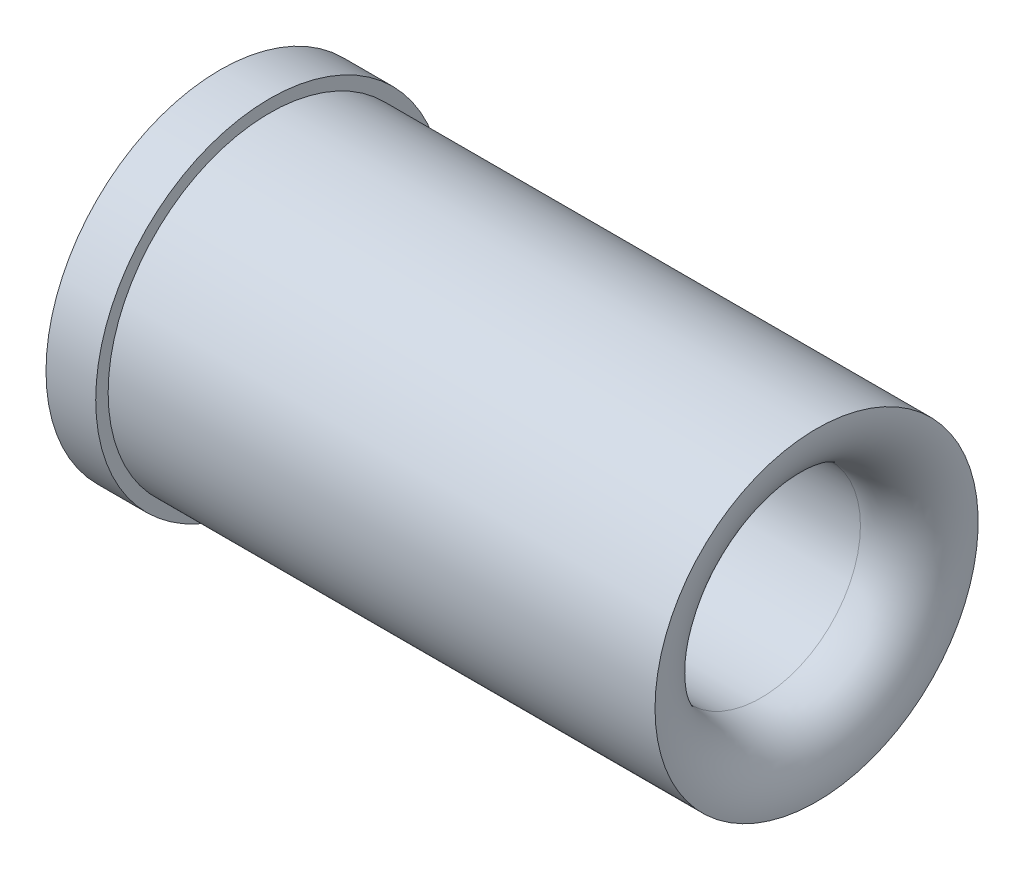
from build123d import *


with BuildPart() as part:
    # Sketch1 → Revolve1 (revolve)
    with BuildSketch(Plane(origin=(0, 0, 0), x_dir=(-1, 0, 0), z_dir=(0, 0, -1)), mode=Mode.PRIVATE) as revolve1_sk:
        with BuildLine():
            Line((-11.294089345, -6.533263235), (-0.912123334, -6.533263235))
            Line((-0.912123334, -6.533263235), (-0.912123334, -5.033263235))
            Line((-0.912123334, -5.033263235), (-1.912123334, -5.033263235))
            Line((-1.912123334, -5.033263235), (-1.912123334, -5.283263235))
            Line((-1.912123334, -5.283263235), (-12.912123334, -5.283263235))
            ThreePointArc((-12.912123334, -5.283263235), (-12.632614837, -6.158263235), (-11.794089345, -6.533263235))
            Line((-11.794089345, -6.533263235), (-11.294089345, -6.533263235))
        make_face()
    revolve(revolve1_sk.sketch.rotate(Axis((12.175741694, -8.533263235, 0), (-1, 0, 0)), 270), axis=Axis((12.175741694, -8.533263235, 0), (-1, 0, 0)))


solid = part.part
